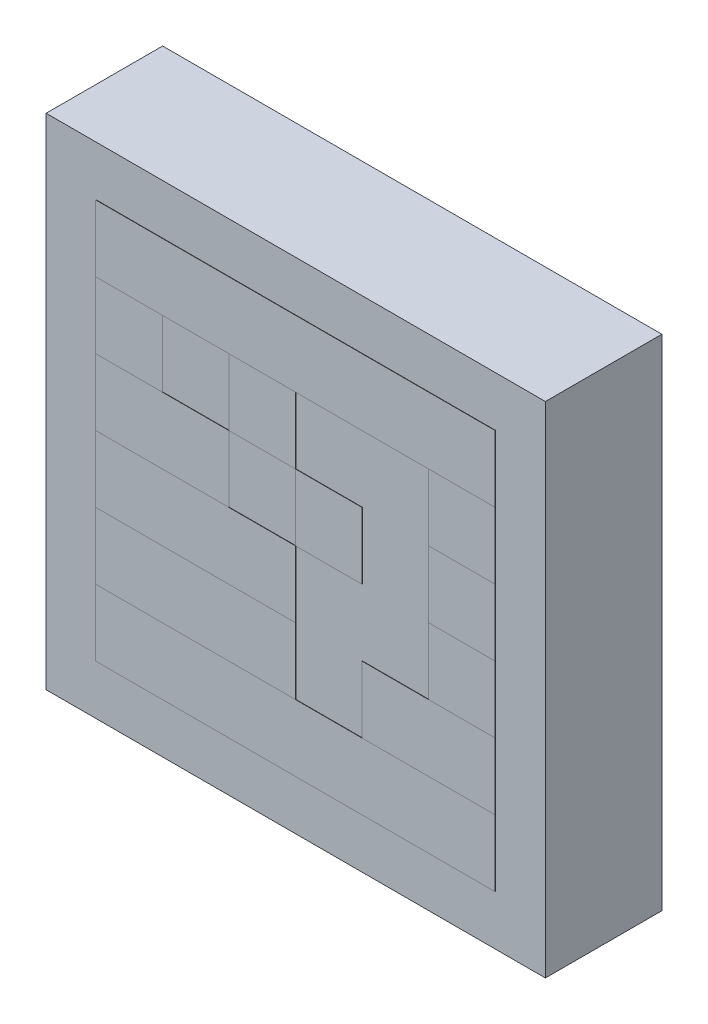
from build123d import *

# Parameters (mm, degrees)
SKETCH_1_W                     = 60
SKETCH_1_H                     = 60
COPLANAR_SUPPORT60X60X14_DEPTH = 14
SKETCH_2_W                     = 48
SKETCH_2_H                     = 8
ID0_ROW0_DEPTH                 = 0.04
SKETCH_3_W                     = 8
SKETCH_3_H                     = 8
ID0_ROW1_DEPTH                 = 0.04
ID0_ROW1_2_DEPTH               = 0.04
ID0_ROW1_3_DEPTH               = 0.04
SKETCH_4_W                     = 16
SKETCH_4_H                     = 8
ID0_ROW2_DEPTH                 = 0.04
SKETCH_4_W_2                   = 8
ID0_ROW2_2_DEPTH               = 0.04
ID0_ROW2_3_DEPTH               = 0.04
SKETCH_5_W                     = 24
SKETCH_5_H                     = 8
ID0_ROW3_DEPTH                 = 0.04
SKETCH_5_W_2                   = 8
ID0_ROW3_2_DEPTH               = 0.04
SKETCH_6_W                     = 24
SKETCH_6_H                     = 8
ID0_ROW4_DEPTH                 = 0.04
SKETCH_6_W_2                   = 16
ID0_ROW4_2_DEPTH               = 0.04
SKETCH_7_W                     = 48
SKETCH_7_H                     = 8
ID0_ROW5_DEPTH                 = 0.04


with BuildPart() as part:
    # 草图1 → Coplanar_support60x60x14 (new body)
    with BuildSketch(Plane.XY):
        Rectangle(SKETCH_1_W, SKETCH_1_H)
    extrude(amount=-COPLANAR_SUPPORT60X60X14_DEPTH)


with BuildPart() as body_2:
    # 草图2 → ID0_row0 (new body)
    with BuildSketch(Plane.XY):
        with Locations((0, 20)):
            Rectangle(SKETCH_2_W, SKETCH_2_H)
    extrude(amount=ID0_ROW0_DEPTH)


with BuildPart() as body_3:
    # 草图3 → ID0_row1 (new body)
    with BuildSketch(Plane.XY):
        with Locations((-20, 12)):
            Rectangle(SKETCH_3_W, SKETCH_3_H)
    extrude(amount=ID0_ROW1_DEPTH)


with BuildPart() as body_4:
    # 草图3 → ID0_row1 2 (new body)
    with BuildSketch(Plane.XY):
        with Locations((-4, 12)):
            Rectangle(SKETCH_3_W, SKETCH_3_H)
    extrude(amount=ID0_ROW1_2_DEPTH)


with BuildPart() as body_5:
    # 草图3 → ID0_row1 3 (new body)
    with BuildSketch(Plane.XY):
        with Locations((20, 12)):
            Rectangle(SKETCH_3_W, SKETCH_3_H)
    extrude(amount=ID0_ROW1_3_DEPTH)


with BuildPart() as body_6:
    # 草图4 → ID0_row2 (new body)
    with BuildSketch(Plane.XY):
        with Locations((-16, 4)):
            Rectangle(SKETCH_4_W, SKETCH_4_H)
    extrude(amount=ID0_ROW2_DEPTH)


with BuildPart() as body_7:
    # 草图4 → ID0_row2 2 (new body)
    with BuildSketch(Plane.XY):
        with Locations((4, 4)):
            Rectangle(SKETCH_4_W_2, SKETCH_4_H)
    extrude(amount=ID0_ROW2_2_DEPTH)


with BuildPart() as body_8:
    # 草图4 → ID0_row2 3 (new body)
    with BuildSketch(Plane.XY):
        with Locations((20, 4)):
            Rectangle(SKETCH_4_W_2, SKETCH_4_H)
    extrude(amount=ID0_ROW2_3_DEPTH)


with BuildPart() as body_9:
    # 草图5 → ID0_row3 (new body)
    with BuildSketch(Plane.XY):
        with Locations((-12, -4)):
            Rectangle(SKETCH_5_W, SKETCH_5_H)
    extrude(amount=ID0_ROW3_DEPTH)


with BuildPart() as body_10:
    # 草图5 → ID0_row3 2 (new body)
    with BuildSketch(Plane.XY):
        with Locations((20, -4)):
            Rectangle(SKETCH_5_W_2, SKETCH_5_H)
    extrude(amount=ID0_ROW3_2_DEPTH)


with BuildPart() as body_11:
    # 草图6 → ID0_row4 (new body)
    with BuildSketch(Plane.XY):
        with Locations((-12, -12)):
            Rectangle(SKETCH_6_W, SKETCH_6_H)
    extrude(amount=ID0_ROW4_DEPTH)


with BuildPart() as body_12:
    # 草图6 → ID0_row4 2 (new body)
    with BuildSketch(Plane.XY):
        with Locations((16, -12)):
            Rectangle(SKETCH_6_W_2, SKETCH_6_H)
    extrude(amount=ID0_ROW4_2_DEPTH)


with BuildPart() as body_13:
    # 草图7 → ID0_row5 (new body)
    with BuildSketch(Plane.XY):
        with Locations((0, -20)):
            Rectangle(SKETCH_7_W, SKETCH_7_H)
    extrude(amount=ID0_ROW5_DEPTH)


solid = Compound([part.part, body_2.part, body_3.part, body_4.part, body_5.part, body_6.part, body_7.part, body_8.part, body_9.part, body_10.part, body_11.part, body_12.part, body_13.part])
